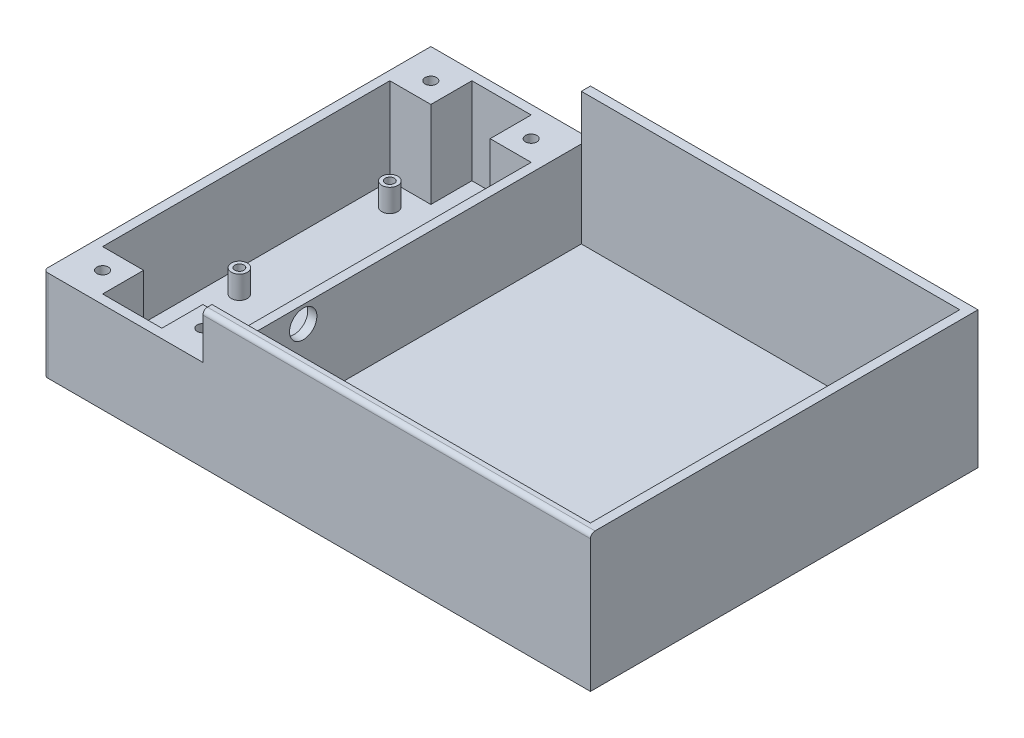
from build123d import *

# Parameters (mm, degrees)
SKETCH1_W           = 120
SKETCH1_H           = 85
BOSS_EXTRUDE1_DEPTH = 30
SKETCH2_W           = 83
SKETCH2_H           = 81
CUT_EXTRUDE1_DEPTH  = 29
SKETCH3_W           = 31
SKETCH3_H           = 81
CUT_EXTRUDE2_DEPTH  = 29
SKETCH4_W           = 35
SKETCH4_H           = 85
CUT_EXTRUDE3_DEPTH  = 10
SKETCH5_W           = 9
SKETCH5_H           = 9
SKETCH5_R           = 1.25
BOSS_EXTRUDE2_DEPTH = 19
SKETCH6_R           = 1.75
SKETCH6_R_2         = 1
BOSS_EXTRUDE3_DEPTH = 5
SKETCH7_W           = 5
SKETCH7_H           = 8.298973679
SKETCH7_R           = 0.9
BOSS_EXTRUDE4_DEPTH = 3
SKETCH8_R           = 3
CUT_EXTRUDE4_DEPTH  = 2
FILLET1_R           = 1


with BuildPart() as part:
    # Sketch1 → Boss-Extrude1 (new body)
    with BuildSketch(Plane(origin=(0, 0, 0), x_dir=(1, 0, 0), z_dir=(0, 1, 0))):
        Rectangle(SKETCH1_W, SKETCH1_H)
    extrude(amount=BOSS_EXTRUDE1_DEPTH)

    # Sketch2 → Cut-Extrude1 (cut)
    with BuildSketch(Plane(origin=(0, 30, 0), x_dir=(1, 0, 0), z_dir=(0, 1, 0))):
        with Locations((16.5, 0)):
            Rectangle(SKETCH2_W, SKETCH2_H)
    extrude(amount=-CUT_EXTRUDE1_DEPTH, mode=Mode.SUBTRACT)

    # Sketch3 → Cut-Extrude2 (cut)
    with BuildSketch(Plane(origin=(0, 30, 0), x_dir=(1, 0, 0), z_dir=(0, 1, 0))):
        with Locations((-42.5, 0)):
            Rectangle(SKETCH3_W, SKETCH3_H)
    extrude(amount=-CUT_EXTRUDE2_DEPTH, mode=Mode.SUBTRACT)

    # Sketch4 → Cut-Extrude3 (cut)
    with BuildSketch(Plane(origin=(0, 30, 0), x_dir=(1, 0, 0), z_dir=(0, 1, 0))):
        with Locations((-42.5, 0)):
            Rectangle(SKETCH4_W, SKETCH4_H)
    extrude(amount=-CUT_EXTRUDE3_DEPTH, mode=Mode.SUBTRACT)

    # Sketch5 → Boss-Extrude2 (add)
    # profile 1 of 4: a face of its own
    with BuildSketch(Plane(origin=(0, 1, 0), x_dir=(1, 0, 0), z_dir=(0, 1, 0))):
        with Locations((-31.5, 36)):
            Rectangle(SKETCH5_W, SKETCH5_H)
        with Locations(Location((-31.5, 36, 0), (0, 0, 270))):
            Circle(SKETCH5_R, mode=Mode.SUBTRACT)
    # profile 2 of 4: a face of its own
    with BuildSketch(Plane(origin=(0, 1, 0), x_dir=(1, 0, 0), z_dir=(0, 1, 0))):
        with Locations((-53.5, 36)):
            Rectangle(SKETCH5_W, SKETCH5_H)
        with Locations(Location((-53.5, 36, 0), (0, 0, 270))):
            Circle(SKETCH5_R, mode=Mode.SUBTRACT)
    # profile 3 of 4: a face of its own
    with BuildSketch(Plane(origin=(0, 1, 0), x_dir=(1, 0, 0), z_dir=(0, 1, 0))):
        with Locations((-31.5, -36)):
            Rectangle(SKETCH5_W, SKETCH5_H)
        with Locations(Location((-31.5, -36, 0), (0, 0, 270))):
            Circle(SKETCH5_R, mode=Mode.SUBTRACT)
    # profile 4 of 4: a face of its own
    with BuildSketch(Plane(origin=(0, 1, 0), x_dir=(1, 0, 0), z_dir=(0, 1, 0))):
        with Locations((-53.5, -36)):
            Rectangle(SKETCH5_W, SKETCH5_H)
        with Locations(Location((-53.5, -36, 0), (0, 0, 270))):
            Circle(SKETCH5_R, mode=Mode.SUBTRACT)
    extrude(amount=BOSS_EXTRUDE2_DEPTH)

    # Sketch6 → Boss-Extrude3 (add)
    # profile 1 of 4: a face of its own
    with BuildSketch(Plane(origin=(0, 1, 0), x_dir=(1, 0, 0), z_dir=(0, 1, 0))):
        with Locations(Location((-53, 26.5, 0), (0, 0, 270))):
            Circle(SKETCH6_R)
        with Locations(Location((-53, 26.5, 0), (0, 0, 270))):
            Circle(SKETCH6_R_2, mode=Mode.SUBTRACT)
    # profile 2 of 4: a face of its own
    with BuildSketch(Plane(origin=(0, 1, 0), x_dir=(1, 0, 0), z_dir=(0, 1, 0))):
        with Locations(Location((-32.000361852, 26.376721252, 0), (0, 0, 270))):
            Circle(SKETCH6_R)
        with Locations(Location((-32.000361852, 26.376721252, 0), (0, 0, 270))):
            Circle(SKETCH6_R_2, mode=Mode.SUBTRACT)
    # profile 3 of 4: a face of its own
    with BuildSketch(Plane(origin=(0, 1, 0), x_dir=(1, 0, 0), z_dir=(0, 1, 0))):
        with Locations(Location((-32.000361852, -6.623278748, 0), (0, 0, 270))):
            Circle(SKETCH6_R)
        with Locations(Location((-32.000361852, -6.623278748, 0), (0, 0, 270))):
            Circle(SKETCH6_R_2, mode=Mode.SUBTRACT)
    # profile 4 of 4: a face of its own
    with BuildSketch(Plane(origin=(0, 1, 0), x_dir=(1, 0, 0), z_dir=(0, 1, 0))):
        with Locations(Location((-53, -6.5, 0), (0, 0, 270))):
            Circle(SKETCH6_R)
        with Locations(Location((-53, -6.5, 0), (0, 0, 270))):
            Circle(SKETCH6_R_2, mode=Mode.SUBTRACT)
    extrude(amount=BOSS_EXTRUDE3_DEPTH)

    # Sketch7 → Boss-Extrude4 (add)
    with BuildSketch(Plane.ZY.offset(27)):
        with Locations((20.5, 5.14948684)):
            Rectangle(SKETCH7_W, SKETCH7_H)
        with Locations((20.5, 6.798973679)):
            Circle(SKETCH7_R, mode=Mode.SUBTRACT)
    extrude(amount=BOSS_EXTRUDE4_DEPTH)

    # Sketch8 → Cut-Extrude4 (cut)
    with BuildSketch(Plane.ZY.offset(27)):
        with Locations((20.5, 16.298973679)):
            Circle(SKETCH8_R)
    extrude(amount=-CUT_EXTRUDE4_DEPTH, mode=Mode.SUBTRACT)

    # Fillet1
    fillet1_edges = [part.edges().sort_by_distance(p)[0] for p in [
        (17.5, 30, 42.5),
        (-60, 10, 42.5),
    ]]
    fillet(fillet1_edges, radius=FILLET1_R)


solid = part.part
